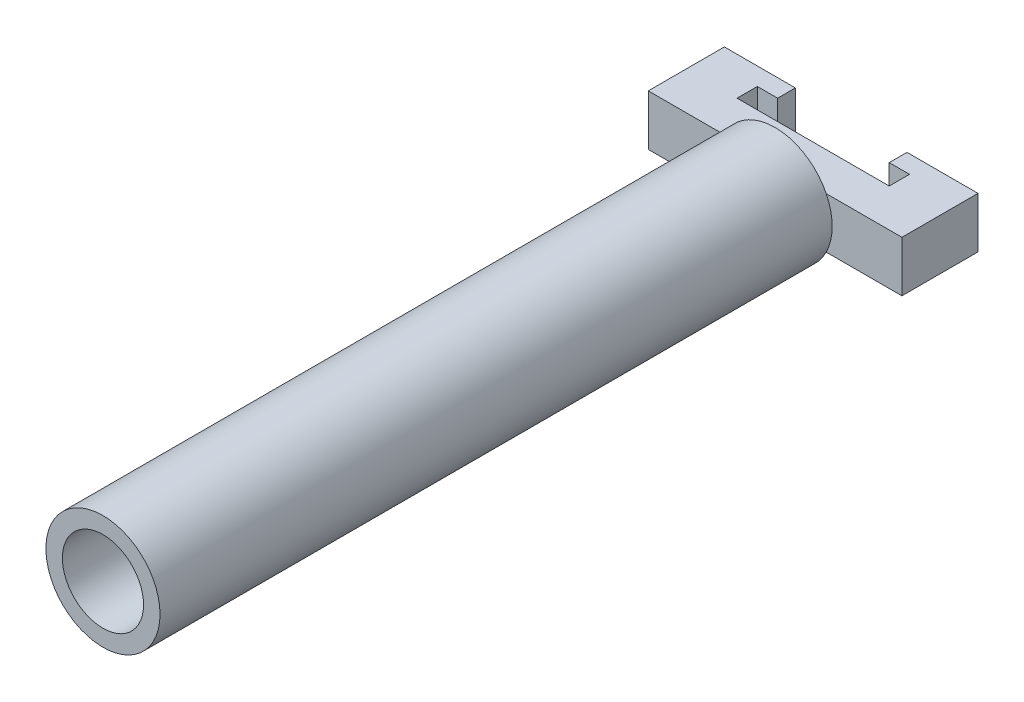
from build123d import *

# Parameters (mm, degrees)
SKETCH1_R           = 2.25
SKETCH1_R_2         = 1.6
BOSS_EXTRUDE1_DEPTH = 25
SKETCH2_R           = 2.25
BOSS_EXTRUDE2_DEPTH = 1.5
SKETCH3_W           = 10
SKETCH3_H           = 2
BOSS_EXTRUDE3_DEPTH = 1.5
SKETCH4_W           = 2
SKETCH4_H           = 2
BOSS_EXTRUDE4_DEPTH = 0.8
SKETCH5_W           = 2.8
SKETCH5_H           = 2
BOSS_EXTRUDE5_DEPTH = 0.7


with BuildPart() as part:
    # Sketch1 → Boss-Extrude1 (new body)
    with BuildSketch(Plane.XY):
        Circle(SKETCH1_R)
        Circle(SKETCH1_R_2, mode=Mode.SUBTRACT)
    extrude(amount=-BOSS_EXTRUDE1_DEPTH)

    # Sketch2 → Boss-Extrude2 (add)
    with BuildSketch(Plane(origin=(0, 0, -25), x_dir=(-1, 0, 0), z_dir=(0, 0, -1))):
        with Locations(Location((0, 0, 0), (0, 0, 180))):
            Circle(SKETCH2_R)
    extrude(amount=BOSS_EXTRUDE2_DEPTH)

    # Sketch3 → Boss-Extrude3 (add)
    with BuildSketch(Plane(origin=(0, 0, -26.5), x_dir=(-1, 0, 0), z_dir=(0, 0, -1))):
        Rectangle(SKETCH3_W, SKETCH3_H)
    extrude(amount=BOSS_EXTRUDE3_DEPTH)

    # Sketch4 → Boss-Extrude4 (add)
    with BuildSketch(Plane(origin=(0, 0, -28), x_dir=(-1, 0, 0), z_dir=(0, 0, -1))):
        with Locations((-4, 0)):
            Rectangle(SKETCH4_W, SKETCH4_H)
        with Locations((4, 0)):
            Rectangle(SKETCH4_W, SKETCH4_H)
    extrude(amount=BOSS_EXTRUDE4_DEPTH)

    # Sketch5 → Boss-Extrude5 (add)
    with BuildSketch(Plane(origin=(0, 0, -28.8), x_dir=(-1, 0, 0), z_dir=(0, 0, -1))):
        with Locations((-3.6, 0)):
            Rectangle(SKETCH5_W, SKETCH5_H)
        with Locations((3.6, 0)):
            Rectangle(SKETCH5_W, SKETCH5_H)
    extrude(amount=BOSS_EXTRUDE5_DEPTH)


solid = part.part
